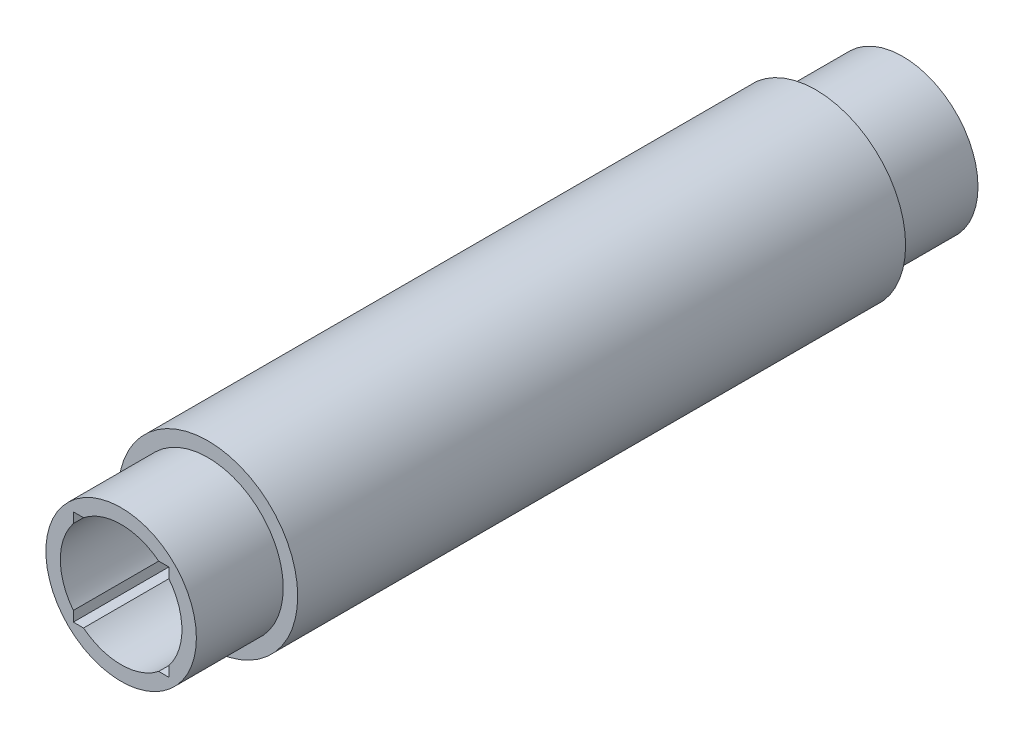
from build123d import *

# Parameters (mm, degrees)
SKETCH1_R           = 5.2
SKETCH1_R_2         = 4.2
BOSS_EXTRUDE2_DEPTH = 27
SKETCH1_3_R         = 6.2
SKETCH1_3_R_2       = 5.2
BOSS_EXTRUDE3_DEPTH = 21
CUT_EXTRUDE1_START  = 27
SKETCH3_W           = 6.6
SKETCH3_H           = 6.6
CUT_EXTRUDE1_DEPTH  = 15
CUT_EXTRUDE2_START  = -27
SKETCH3_3_W         = 6.6
SKETCH3_3_H         = 6.6
CUT_EXTRUDE2_DEPTH  = 15


with BuildPart() as part:
    # Sketch1 → Boss-Extrude2 (new, symmetric)
    with BuildSketch(Plane.XY):
        Circle(SKETCH1_R)
        Circle(SKETCH1_R_2, mode=Mode.SUBTRACT)
    extrude(amount=BOSS_EXTRUDE2_DEPTH, both=True)

    # Sketch1<3> → Boss-Extrude3 (add, symmetric)
    with BuildSketch(Plane.XY):
        with Locations(Location((0, 0, 0), (0, 0, 180))):
            Circle(SKETCH1_3_R)
        Circle(SKETCH1_3_R_2, mode=Mode.SUBTRACT)
    extrude(amount=BOSS_EXTRUDE3_DEPTH, both=True)

    # Sketch3 → Cut-Extrude1 (cut)
    with BuildSketch(Plane.XY.offset(CUT_EXTRUDE1_START)):
        Rectangle(SKETCH3_W, SKETCH3_H)
    extrude(amount=-CUT_EXTRUDE1_DEPTH, mode=Mode.SUBTRACT)

    # Sketch3<3> → Cut-Extrude2 (cut)
    with BuildSketch(Plane.XY.offset(CUT_EXTRUDE2_START)):
        Rectangle(SKETCH3_3_W, SKETCH3_3_H)
    extrude(amount=CUT_EXTRUDE2_DEPTH, mode=Mode.SUBTRACT)


solid = part.part
